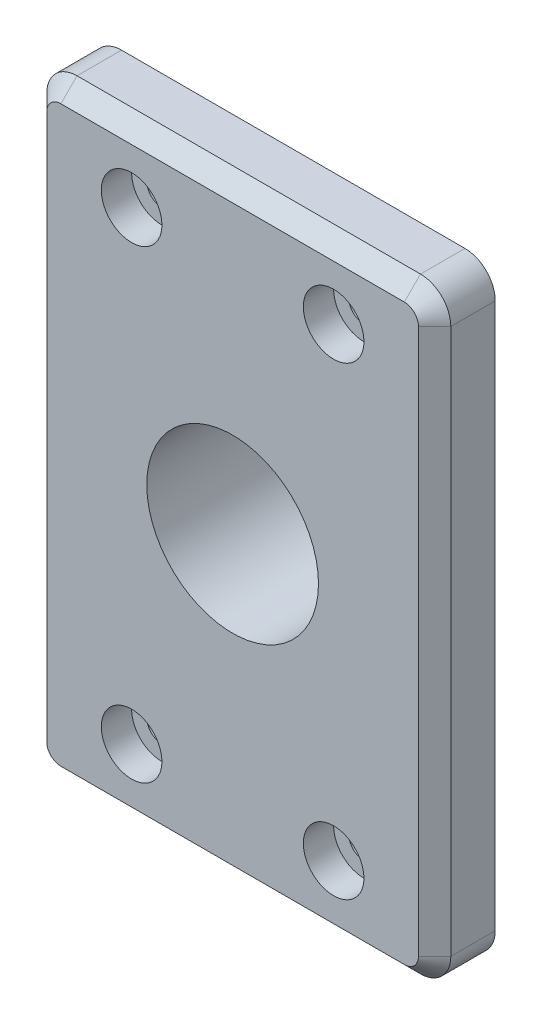
from build123d import *

# Parameters (mm, degrees)
SKETCH_1_W          = 40
SKETCH_1_H          = 60
SKETCH_1_R          = 1.5
EXTRUDE_1_DEPTH     = 6
SKETCH_2_R          = 3
CUT_EXTRUDE_1_DEPTH = 3
FILLET_1_R          = 3
CHAMFER_1_SIZE      = 1.6
SKETCH_3_R          = 8.5
CUT_EXTRUDE_2_DEPTH = 37.551333765
SKETCH_4_R          = 11.5
SKETCH_4_R_2        = 8.5
EXTRUDE_2_DEPTH     = 6


with BuildPart() as part:
    # 草圖1 → 填料-伸長1 (new body)
    with BuildSketch(Plane.XY):
        Rectangle(SKETCH_1_W, SKETCH_1_H)
        with Locations((-10, 23)):
            Circle(SKETCH_1_R, mode=Mode.SUBTRACT)
        with Locations(Location((10, 23, 0), (0, 0, 180))):
            Circle(SKETCH_1_R, mode=Mode.SUBTRACT)
        with Locations((10, -23)):
            Circle(SKETCH_1_R, mode=Mode.SUBTRACT)
        with Locations(Location((-10, -23, 0), (0, 0, 180))):
            Circle(SKETCH_1_R, mode=Mode.SUBTRACT)
    extrude(amount=EXTRUDE_1_DEPTH)

    # 草圖2 → 除料-伸長1 (cut)
    with BuildSketch(Plane.XY.offset(6)):
        with Locations((-10, 23)):
            Circle(SKETCH_2_R)
        with Locations((10, 23)):
            Circle(SKETCH_2_R)
        with Locations((10, -23)):
            Circle(SKETCH_2_R)
        with Locations((-10, -23)):
            Circle(SKETCH_2_R)
    extrude(amount=-CUT_EXTRUDE_1_DEPTH, mode=Mode.SUBTRACT)

    # 圓角1
    fillet_1_edges = [part.edges().sort_by_distance(p)[0] for p in [
        (-20, 30, 3),
        (20, 30, 3),
        (20, -30, 3),
        (-20, -30, 3),
    ]]
    fillet(fillet_1_edges, radius=FILLET_1_R)

    # 導角1
    chamfer_1_edges = [part.edges().sort_by_distance(p)[0] for p in [
        (0, -30, 6),
        (-20, 0, 6),
        (20, 0, 6),
        (0, 30, 6),
        (19.121320344, 29.121320344, 6),
        (-19.121320344, 29.121320344, 6),
        (19.121320344, -29.121320344, 6),
        (-19.121320344, -29.121320344, 6),
    ]]
    chamfer(chamfer_1_edges, length=CHAMFER_1_SIZE)

    # 草圖3 → 除料-伸長2 (cut, through all)
    with BuildSketch(Plane.XY.offset(6)):
        Circle(SKETCH_3_R)
    extrude(amount=-CUT_EXTRUDE_2_DEPTH, mode=Mode.SUBTRACT)

    # 草圖4 → 填料-伸長2 (add)
    with BuildSketch(Plane(origin=(0, 0, 0), x_dir=(-1, 0, 0), z_dir=(0, 0, -1))):
        with Locations(Location((0, 0, 0), (0, 0, 180))):
            Circle(SKETCH_4_R)
        with Locations(Location((0, 0, 0), (0, 0, 180))):
            Circle(SKETCH_4_R_2, mode=Mode.SUBTRACT)
    extrude(amount=EXTRUDE_2_DEPTH)


solid = part.part
